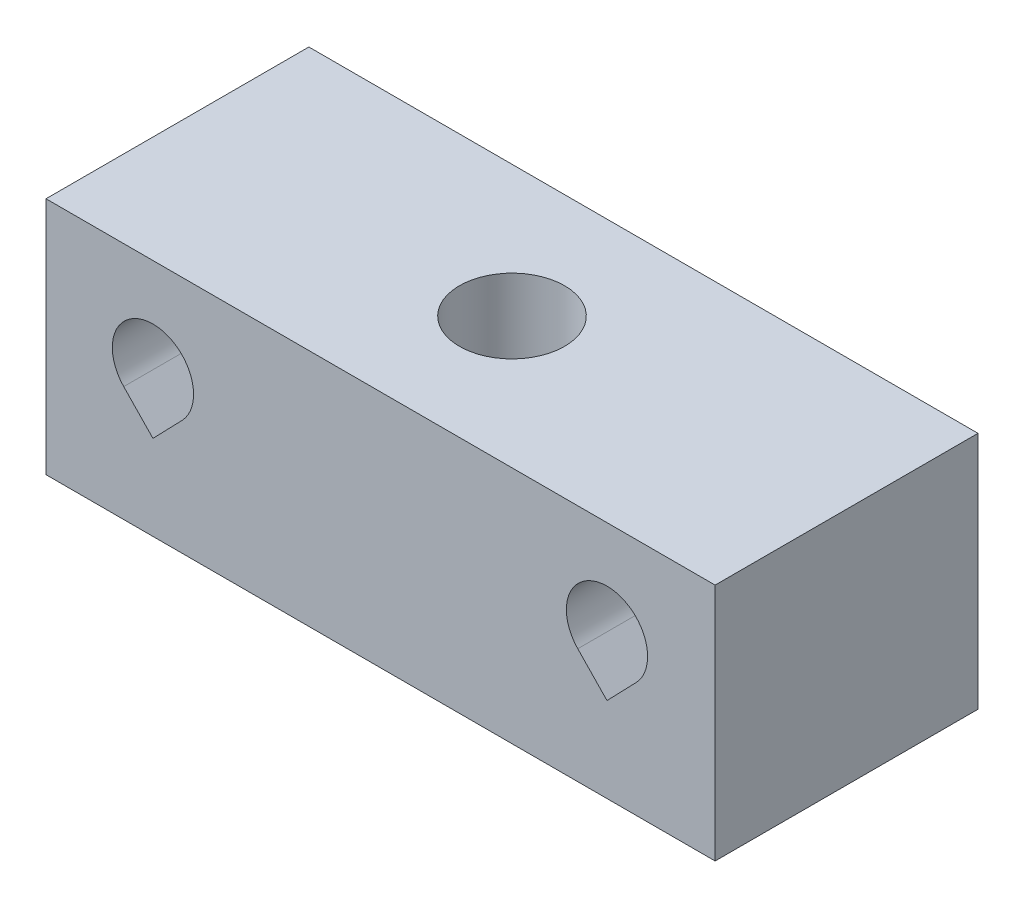
from build123d import *

# Parameters (mm, degrees)
SKETCH1_W           = 28
SKETCH1_H           = 11
BOSS_EXTRUDE1_DEPTH = 10
CUT_EXTRUDE1_DEPTH  = 62.911246959
CUT_EXTRUDE2_DEPTH  = 62.911246959
HOLE1_D             = 4.4


with BuildPart() as part:
    # Sketch1 → Boss-Extrude1 (new body)
    with BuildSketch(Plane.XZ.offset(46)):
        with Locations((25.95, 5.5)):
            Rectangle(SKETCH1_W, SKETCH1_H)
    extrude(amount=-BOSS_EXTRUDE1_DEPTH)

    # Sketch2 → Cut-Extrude1 (cut, through all)
    with BuildSketch(Plane.XY.offset(11)):
        with BuildLine():
            Line((35.425, -42.447246117), (36.647877661, -41.18091923))
            ThreePointArc((36.647877661, -41.18091923), (35.425, -38.3), (34.202122339, -41.18091923))
            Line((34.202122339, -41.18091923), (35.425, -42.447246117))
        make_face()
    extrude(amount=-CUT_EXTRUDE1_DEPTH, mode=Mode.SUBTRACT)

    # Sketch3 → Cut-Extrude2 (cut, through all)
    with BuildSketch(Plane(origin=(0, 0, 0), x_dir=(-1, 0, 0), z_dir=(0, 0, -1))):
        with BuildLine():
            Line((-17.647877661, -41.18091923), (-16.425, -42.447246117))
            Line((-16.425, -42.447246117), (-15.202122339, -41.18091923))
            ThreePointArc((-15.202122339, -41.18091923), (-16.425, -38.3), (-17.647877661, -41.18091923))
        make_face()
    extrude(amount=-CUT_EXTRUDE2_DEPTH, mode=Mode.SUBTRACT)

    # Hole1 (through all)
    with Locations(Plane.XZ.offset(46)):
        with Locations((25.95, 5.5)):
            Hole(HOLE1_D / 2)


solid = part.part
